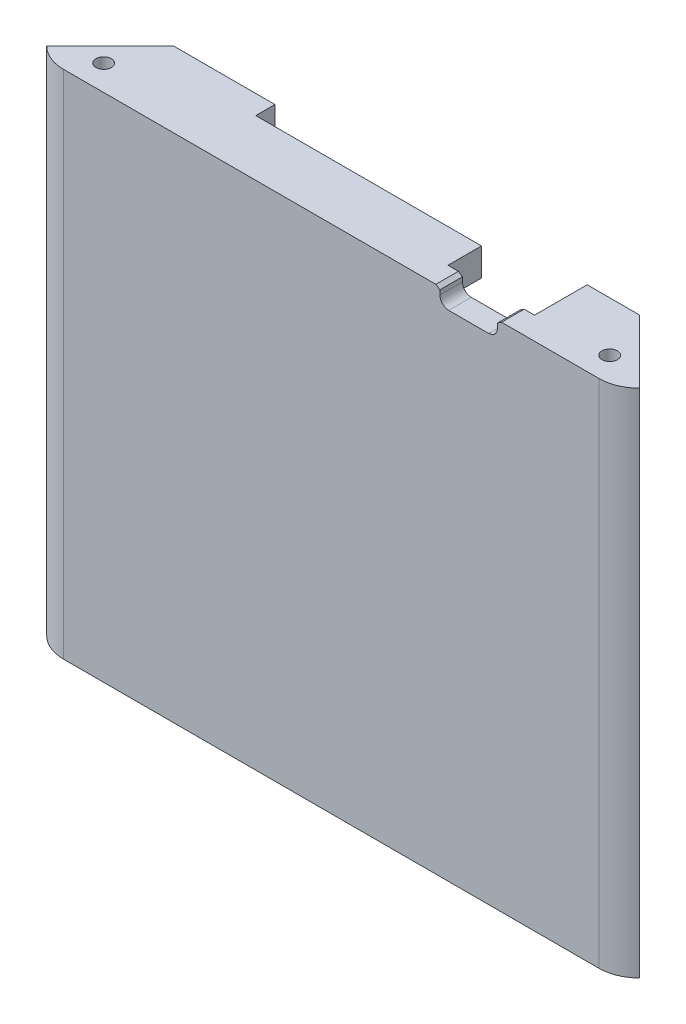
from build123d import *

# Parameters (mm, degrees)
SKETCH_1_W            = 81.9
SKETCH_1_H            = 67.9
EXTRUDE_1_DEPTH       = 10
SKETCH_2_W            = 60.5
SKETCH_2_H            = 60.5
CUT_EXTRUDE_1_DEPTH   = 8.5
CUT_EXTRUDE_4_REACH   = 91.242
M2_5X0_451_AT_2_COUNT = 2
M2_5X0_451_AT_2_PITCH = 67.264213562
CUT_EXTRUDE_5_REACH   = 81.921
CUT_EXTRUDE_6_REACH   = 81.129
CUT_EXTRUDE_7_REACH   = 54.949


with BuildPart() as part:
    # Эскиз1 → Бобышка-Вытянуть1 (new body)
    with BuildSketch(Plane.XY):
        Rectangle(SKETCH_1_W, SKETCH_1_H)
    extrude(amount=-EXTRUDE_1_DEPTH)

    # Эскиз2 → Вырез-Вытянуть1 (cut)
    with BuildSketch(Plane(origin=(0, 0, -10), x_dir=(-1, 0, 0), z_dir=(0, 0, -1))):
        Rectangle(SKETCH_2_W, SKETCH_2_H)
    extrude(amount=-CUT_EXTRUDE_1_DEPTH, mode=Mode.SUBTRACT)

    # Эскиз4 → Вырез-Вытянуть4 (cut, up to next)
    with BuildSketch(Plane(origin=(0, -33.95, -40.95), x_dir=(1, 0, 0), z_dir=(0, 1, 0)), mode=Mode.PRIVATE) as cut_extrude_4_sk1:
        with BuildLine():
            Line((39.383021279, -39.383021279), (40.95, -40.95))
            Line((40.95, -40.95), (35.6, -40.95))
            ThreePointArc((35.6, -40.95), (37.647356363, -40.542755499), (39.383021279, -39.383021279))
        make_face()
    cut_extrude_4_tool1 = extrude(cut_extrude_4_sk1.sketch, amount=CUT_EXTRUDE_4_REACH, mode=Mode.PRIVATE) & part.part
    # Эскиз4 → Вырез-Вытянуть4 (cut, up to next)
    with BuildSketch(Plane(origin=(0, -33.95, -40.95), x_dir=(1, 0, 0), z_dir=(0, 1, 0)), mode=Mode.PRIVATE) as cut_extrude_4_sk2:
        with BuildLine():
            Line((-40.95, -40.95), (-35.6, -40.95))
            ThreePointArc((-35.6, -40.95), (-37.647356363, -40.542755499), (-39.383021279, -39.383021279))
            Line((-39.383021279, -39.383021279), (-40.95, -40.95))
        make_face()
    cut_extrude_4_tool2 = extrude(cut_extrude_4_sk2.sketch, amount=CUT_EXTRUDE_4_REACH, mode=Mode.PRIVATE) & part.part
    add(cut_extrude_4_tool1.solids().sort_by_distance((39.042099, -33.95, -0.482136))[0], mode=Mode.SUBTRACT)
    add(cut_extrude_4_tool2.solids().sort_by_distance((-39.042099, -33.95, -0.482136))[0], mode=Mode.SUBTRACT)

    # Эскиз8 → Отверстие обработанное метчиком M2.5x0.451 (revolve, cut)
    with BuildSketch(Plane(origin=(33.632106781, 33.95, -3.382106781), x_dir=(0, 0, 1), z_dir=(1, 0, 0))):
        Polygon((0, 0), (0, 5.615882135), (1.025, 5), (1.025, 0), align=None)
    m2_5x0_451 = revolve(axis=Axis((33.632106781, 40.3, -3.382106781), (0, -1, 0)), mode=Mode.SUBTRACT)

    # Отверстие обработанное метчиком M2.5x0.451 at 2: Отверстие обработанное метчиком M2.5x0.451 ×2
    with Locations(*[(-i * M2_5X0_451_AT_2_PITCH, 0, 0) for i in range(1, M2_5X0_451_AT_2_COUNT)]):
        add(m2_5x0_451, mode=Mode.SUBTRACT)

    # Зеркальное отражение1: Отверстие обработанное метчиком M2.5x0.451 across plane
    add(m2_5x0_451.mirror(Plane.ZX), mode=Mode.SUBTRACT)

    # Зеркальное отражение1 copy 1 sketch → Зеркальное отражение1 copy 1 (revolve, cut)
    with BuildSketch(Plane(origin=(-33.632106781, -33.95, -3.382106781), x_dir=(0, 0, 1), z_dir=(1, 0, 0))):
        Polygon((0, 0), (0, -5.615882135), (1.025, -5), (1.025, 0), align=None)
    revolve(axis=Axis((-33.632106781, -40.3, -3.382106781), (0, -1, 0)), mode=Mode.SUBTRACT)

    # Эскиз3 → Вырез-Вытянуть5 (cut, up to next)
    with BuildSketch(Plane(origin=(0, 33.95, 0), x_dir=(1, 0, 0), z_dir=(0, 1, 0)), mode=Mode.PRIVATE) as cut_extrude_5_sk1:
        Polygon((30.95, 10), (40.95, 0), (40.95, 10), align=None)
    cut_extrude_5_tool1 = extrude(cut_extrude_5_sk1.sketch, amount=-CUT_EXTRUDE_5_REACH, mode=Mode.PRIVATE) & part.part
    # Эскиз3 → Вырез-Вытянуть5 (cut, up to next)
    with BuildSketch(Plane(origin=(0, 33.95, 0), x_dir=(1, 0, 0), z_dir=(0, 1, 0)), mode=Mode.PRIVATE) as cut_extrude_5_sk2:
        Polygon((-30.95, 10), (-40.95, 10), (-40.95, 0), align=None)
    cut_extrude_5_tool2 = extrude(cut_extrude_5_sk2.sketch, amount=-CUT_EXTRUDE_5_REACH, mode=Mode.PRIVATE) & part.part
    add(cut_extrude_5_tool1.solids().sort_by_distance((37.616667, 33.95, -6.666667))[0], mode=Mode.SUBTRACT)
    add(cut_extrude_5_tool2.solids().sort_by_distance((-37.616667, 33.95, -6.666667))[0], mode=Mode.SUBTRACT)

    # Эскиз10 → Вырез-Вытянуть6 (cut, up to next)
    with BuildSketch(Plane(origin=(0, 33.95, 0), x_dir=(1, 0, 0), z_dir=(0, 1, 0)), mode=Mode.PRIVATE) as cut_extrude_6_sk1:
        Polygon((24.022188141, 3.002183714), (12.522188141, 3.002183714), (12.522188141, 7.45), (-17.477811859, 7.45), (-17.477811859, 10), (12.522188141, 10), (24.022188141, 10), align=None)
    cut_extrude_6_tool1 = extrude(cut_extrude_6_sk1.sketch, amount=-CUT_EXTRUDE_6_REACH, mode=Mode.PRIVATE) & part.part
    add(cut_extrude_6_tool1.solids().sort_by_distance((8.159902, 33.95, -7.584889))[0], mode=Mode.SUBTRACT)

    # Эскиз11 → Вырез-Вытянуть7 (cut, up to next)
    with BuildSketch(Plane.XY, mode=Mode.PRIVATE) as cut_extrude_7_sk1:
        with BuildLine():
            Line((14.437188141, 33.571201289), (14.437188141, 32.976592334))
            add(Edge.make_bspline(
                [(14.437188141, 32.976592334), (14.451126829, 32.828049776), (14.506397384, 32.534626701), (14.763436949, 32.126248808), (15.171814842, 31.869209242), (15.465237917, 31.813938687), (15.613780476, 31.8)],
                knots=[-0.018208692, -0.018208692, -0.018208692, -0.018208692, 0.240895654, 0.5, 0.759104346, 1.018208692, 1.018208692, 1.018208692, 1.018208692], degree=3))
            Line((15.613780476, 31.8), (20.930595807, 31.8))
            add(Edge.make_bspline(
                [(20.930595807, 31.8), (21.079138366, 31.813938687), (21.37256144, 31.869209242), (21.780939333, 32.126248808), (22.037978899, 32.534626701), (22.093249454, 32.828049776), (22.107188141, 32.976592334)],
                knots=[-0.018208692, -0.018208692, -0.018208692, -0.018208692, 0.240895654, 0.5, 0.759104346, 1.018208692, 1.018208692, 1.018208692, 1.018208692], degree=3))
            Line((22.107188141, 32.976592334), (22.107188141, 33.591493881))
            add(Edge.make_bspline(
                [(22.107188141, 33.591493881), (22.535068025, 33.877662587), (22.962947908, 34.163831294), (23.390827792, 34.45)],
                knots=[1.333301569, 1.333301569, 1.333301569, 1.333301569, 6.343818338, 6.343818338, 6.343818338, 6.343818338], degree=3))
            Line((23.390827792, 34.45), (13.216758216, 34.45))
            add(Edge.make_bspline(
                [(13.216758216, 34.45), (13.623568191, 34.157067096), (14.030378166, 33.864134193), (14.437188141, 33.571201289)],
                knots=[1.296985877, 1.296985877, 1.296985877, 1.296985877, 5.968647001, 5.968647001, 5.968647001, 5.968647001], degree=3))
        make_face()
    cut_extrude_7_tool1 = extrude(cut_extrude_7_sk1.sketch, amount=-CUT_EXTRUDE_7_REACH, mode=Mode.PRIVATE) & part.part
    add(cut_extrude_7_tool1.solids().sort_by_distance((18.275758, 33.211289, 0))[0], mode=Mode.SUBTRACT)


solid = part.part
